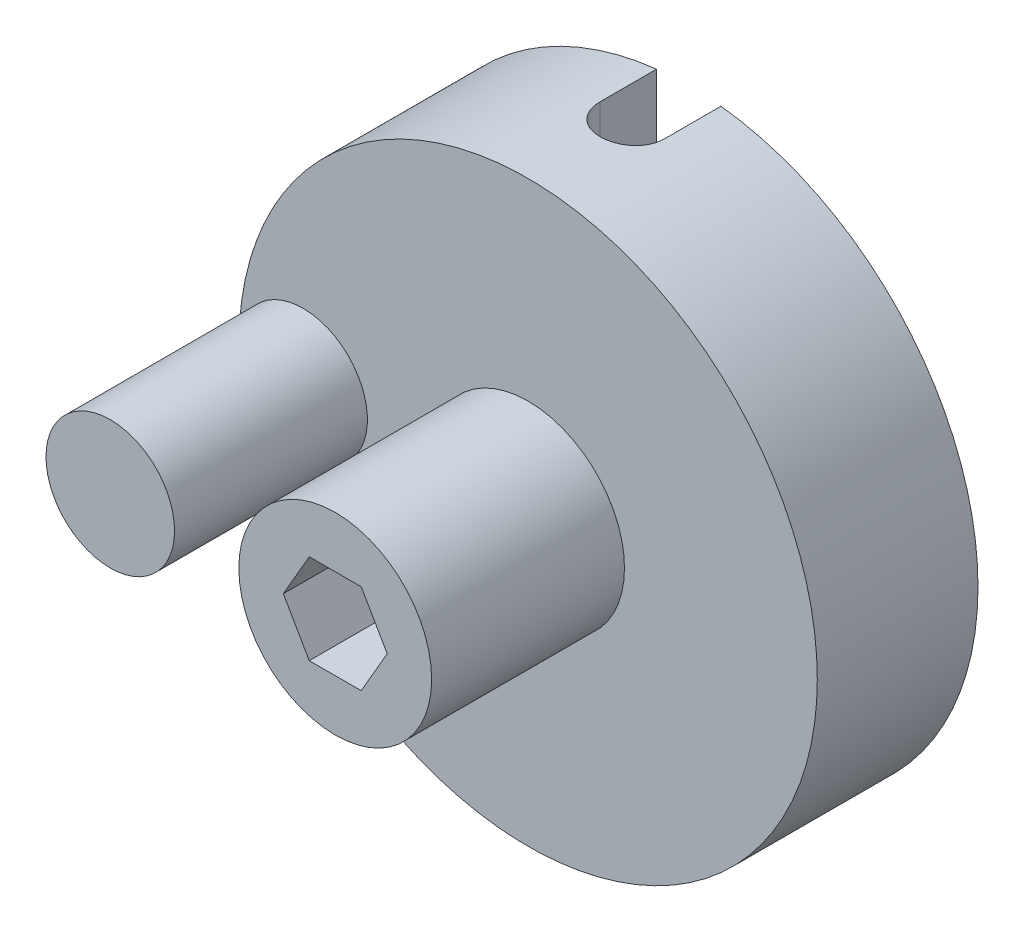
from build123d import *

# Parameters (mm, degrees)
SKETCH1_R           = 9
BOSS_EXTRUDE1_DEPTH = 5
SKETCH2_R           = 3
SKETCH2_R_2         = 2
BOSS_EXTRUDE2_DEPTH = 6
CUT_EXTRUDE1_DEPTH  = 17.822603841
CUT_EXTRUDE2_DEPTH  = 3
CUT_EXTRUDE3_DEPTH  = 8


with BuildPart() as part:
    # Sketch1 → Boss-Extrude1 (new body)
    with BuildSketch(Plane.XY):
        Circle(SKETCH1_R)
    extrude(amount=BOSS_EXTRUDE1_DEPTH)

    # Sketch2 → Boss-Extrude2 (add)
    with BuildSketch(Plane.XY.offset(5)):
        Circle(SKETCH2_R)
        with Locations(Location((-7, 0, 0), (0, 0, 179.999350333))):
            Circle(SKETCH2_R_2)
    extrude(amount=BOSS_EXTRUDE2_DEPTH)

    # Sketch3 → Cut-Extrude1 (cut, through all)
    with BuildSketch(Plane.XY.offset(11)):
        Polygon((-1.616580754, 0), (-0.808290377, -1.4), (0.808290377, -1.4), (1.616580754, 0), (0.808290377, 1.4), (-0.808290377, 1.4), align=None)
    extrude(amount=-CUT_EXTRUDE1_DEPTH, mode=Mode.SUBTRACT)

    # Sketch4 → Cut-Extrude2 (cut)
    with BuildSketch(Plane(origin=(0, 0, 0), x_dir=(-1, 0, 0), z_dir=(0, 0, -1))):
        Polygon((-4.099186911, 0), (-2.049593456, -3.55), (2.049593456, -3.55), (4.099186911, 0), (2.049593456, 3.55), (-2.049593456, 3.55), align=None)
    extrude(amount=-CUT_EXTRUDE2_DEPTH, mode=Mode.SUBTRACT)

    # Sketch5 → Cut-Extrude3 (cut)
    with BuildSketch(Plane.XZ.offset(-3.55)):
        with BuildLine():
            Line((1, 1.756249669), (1, -1.040433474))
            Line((1, -1.040433474), (-1, -1.040433474))
            Line((-1, -1.040433474), (-1, 1.756249669))
            ThreePointArc((-1, 1.756249669), (0, 2.756249669), (1, 1.756249669))
        make_face()
    extrude(amount=-CUT_EXTRUDE3_DEPTH, mode=Mode.SUBTRACT)


solid = part.part
